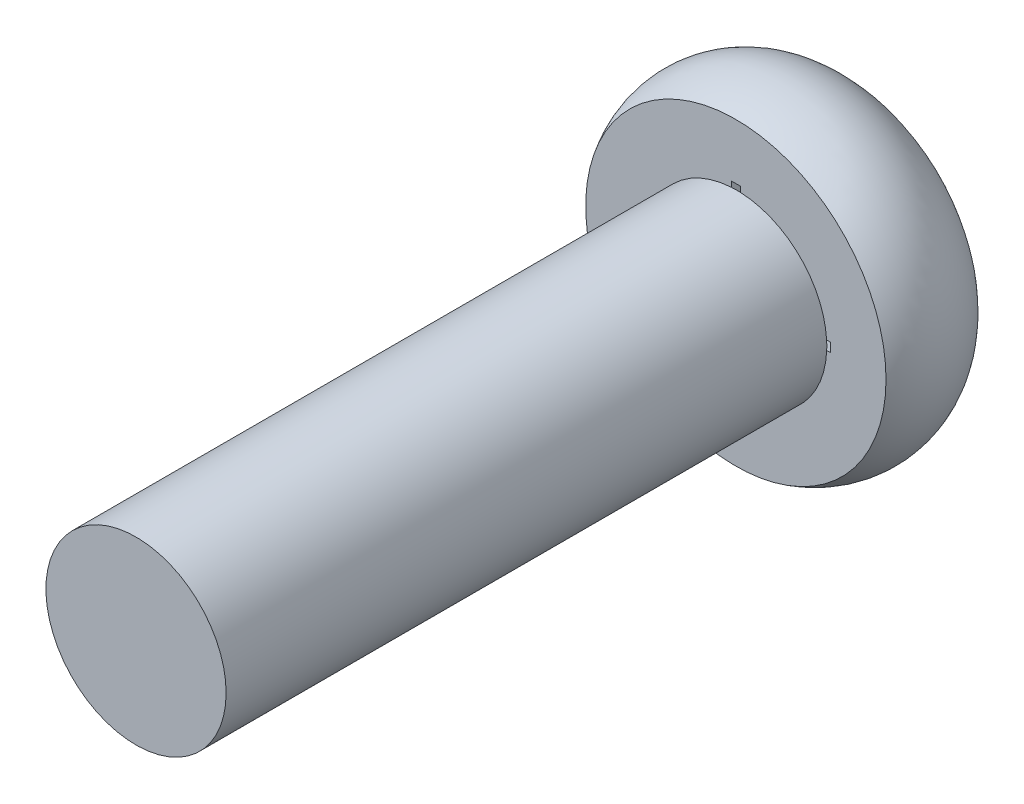
from build123d import *

# Parameters (mm, degrees)
CUT_EXTRUDE1_DEPTH  = 2
CUT_EXTRUDE1_DRAFT  = -12
SKETCH3_R           = 1.5
BOSS_EXTRUDE1_DEPTH = 10


with BuildPart() as part:
    # Sketch1 → Revolve2 (revolve)
    with BuildSketch(Plane(origin=(0, 0, 0), x_dir=(1, 0, 0), z_dir=(0, 1, 0))):
        with BuildLine():
            Line((0, 0), (0, 2))
            Line((0, 2), (1.798285661, 2))
            ThreePointArc((1.798285661, 2), (1.941964308, 1.978911731), (2.07352322, 1.917425786))
            ThreePointArc((2.07352322, 1.917425786), (2.674697589, 1.044998208), (2.5, 0))
            Line((2.5, 0), (0, 0))
        make_face()
    revolve(axis=Axis((0, 0, -0.65925001), (0, 0, -1)))


with BuildPart() as cut_extrude1_tool:
    # Sketch2 → Cut-Extrude1 (with draft: the straight prism first)
    with BuildSketch(Plane(origin=(0, 0, -2), x_dir=(-1, 0, 0), z_dir=(0, 0, -1))):
        Polygon((0.5, -0.5), (2, -0.5), (2, 0.5), (0.5, 0.5), (0.5, 2), (-0.5, 2), (-0.5, 0.5), (-2, 0.5), (-2, -0.5), (-0.5, -0.5), (-0.5, -2), (0.5, -2), align=None)
    extrude(amount=-CUT_EXTRUDE1_DEPTH)
    # Cut-Extrude1: the draft: its side faces are tilted about the plane it starts from
    cut_extrude1_sides = [cut_extrude1_tool.faces().sort_by_distance(p)[0] for p in [
        (-1.25, -0.5, -1),
        (-2, 0, -1),
        (-1.25, 0.5, -1),
        (-0.5, 1.25, -1),
        (0, 2, -1),
        (0.5, 1.25, -1),
        (1.25, 0.5, -1),
        (2, 0, -1),
        (1.25, -0.5, -1),
        (0.5, -1.25, -1),
        (0, -2, -1),
        (-0.5, -1.25, -1),
    ]]
    draft(cut_extrude1_sides, Plane(origin=(0, 0, -2), x_dir=(-1, 0, 0), z_dir=(0, 0, -1)), CUT_EXTRUDE1_DRAFT)


with BuildPart() as part_1:
    add(part.part)

    # Cut-Extrude1: cut by cut_extrude1_tool
    add(cut_extrude1_tool.part, mode=Mode.SUBTRACT)

    # Sketch3 → Boss-Extrude1 (add)
    with BuildSketch(Plane.XY):
        with Locations(Location((0.013589602, -0.013589602, 0), (0, 0, 182.342035556))):
            Circle(SKETCH3_R)
    extrude(amount=BOSS_EXTRUDE1_DEPTH)


solid = part_1.part
